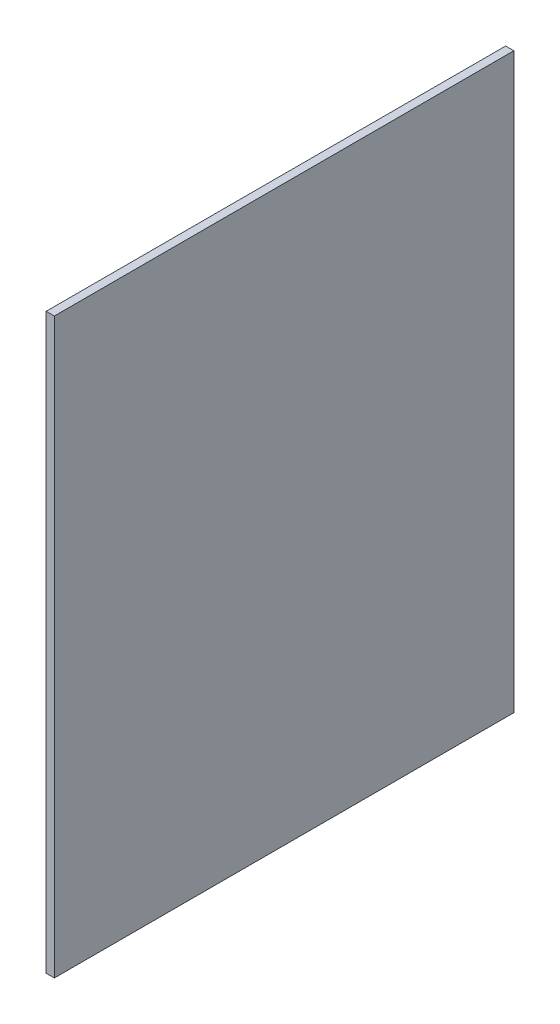
from build123d import *

# Parameters (mm, degrees)
CROQUIS1_W              = 280.5
CROQUIS1_H              = 350
SALIENTE_EXTRUIR1_DEPTH = 5


with BuildPart() as part:
    # Croquis1 → Saliente-Extruir1 (new body)
    with BuildSketch(Plane(origin=(0, 0, 0), x_dir=(0, 0, -1), z_dir=(1, 0, 0))):
        with Locations((35.778061224, 114.535076531)):
            Rectangle(CROQUIS1_W, CROQUIS1_H)
    extrude(amount=SALIENTE_EXTRUIR1_DEPTH)


solid = part.part
